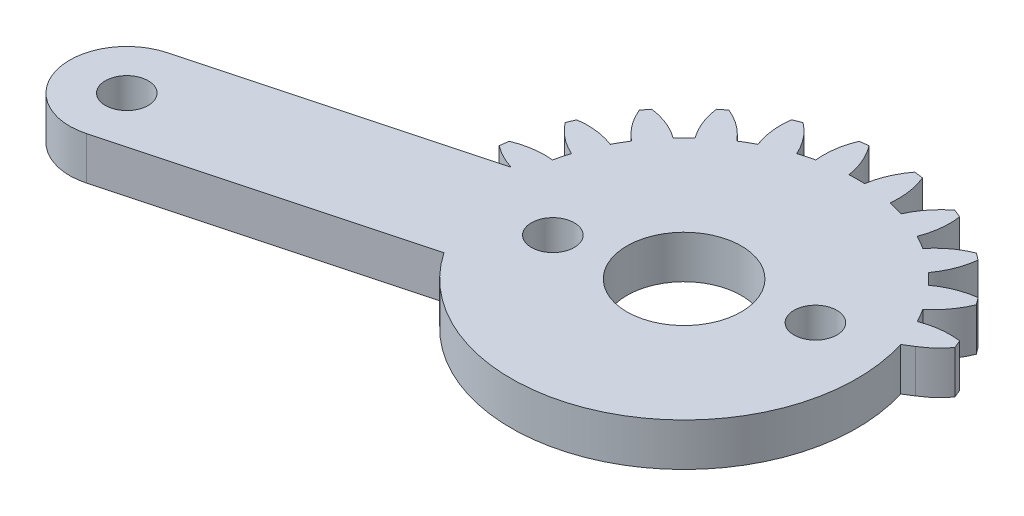
from build123d import *
from build123d.topology import SkipClean

# Parameters (mm, degrees)
SKETCH1_R           = 1.5
BOSS_EXTRUDE1_DEPTH = 3
SKETCH3_R           = 1.5
BOSS_EXTRUDE2_DEPTH = 3
CUT_EXTRUDE1_START  = -3
CUT_EXTRUDE1_DEPTH  = 3
CUT_EXTRUDE2_REACH  = 49.249
SKETCH5_R           = 1.5
SKETCH5_R_2         = 4


with BuildPart() as part:
    # Sketch1 → Boss-Extrude1 (new body)
    with BuildSketch(Plane(origin=(0, 0, 0), x_dir=(1, 0, 0), z_dir=(0, 1, 0))):
        with BuildLine():
            Line((20.643657446, 4), (2.081641936, 4))
            ThreePointArc((2.081641936, 4), (2.861028333, 4.588201733), (3.521749436, 5.30713988))
            ThreePointArc((3.521749436, 5.30713988), (3.405395609, 5.596745198), (3.282888305, 5.883801663))
            ThreePointArc((3.282888305, 5.883801663), (1.93527598, 5.894040025), (0.627094961, 5.57027124))
            ThreePointArc((0.627094961, 5.57027124), (0.366286148, 6.046375), (0.084372603, 6.510293938))
            ThreePointArc((0.084372603, 6.510293938), (1.018855105, 7.48132754), (1.683794586, 8.65351323))
            ThreePointArc((1.683794586, 8.65351323), (1.496450048, 8.903135899), (1.303821399, 9.148703928))
            ThreePointArc((1.303821399, 9.148703928), (-0.000522033, 8.809805691), (-1.180330337, 8.158486898))
            ThreePointArc((-1.180330337, 8.158486898), (-1.555477026, 8.550865528), (-1.947855656, 8.926012217))
            ThreePointArc((-1.947855656, 8.926012217), (-1.296536862, 10.105820521), (-0.957638625, 11.410163953))
            ThreePointArc((-0.957638625, 11.410163953), (-1.203206655, 11.602792602), (-1.452829324, 11.79013714))
            ThreePointArc((-1.452829324, 11.79013714), (-2.625015014, 11.125197659), (-3.596048616, 10.190715157))
            ThreePointArc((-3.596048616, 10.190715157), (-4.059967554, 10.472628702), (-4.536071314, 10.733437515))
            ThreePointArc((-4.536071314, 10.733437515), (-4.212302529, 12.041618533), (-4.222540891, 13.389230859))
            ThreePointArc((-4.222540891, 13.389230859), (-4.509597355, 13.511738163), (-4.799202674, 13.62809199))
            ThreePointArc((-4.799202674, 13.62809199), (-5.759348103, 12.682425791), (-6.455432668, 11.528463019))
            ThreePointArc((-6.455432668, 11.528463019), (-6.976508546, 11.680699536), (-7.503891752, 11.809396783))
            ThreePointArc((-7.503891752, 11.809396783), (-7.529737283, 13.156800143), (-7.888414517, 14.455843809))
            ThreePointArc((-7.888414517, 14.455843809), (-8.197396993, 14.499881098), (-8.507248835, 14.537314892))
            ThreePointArc((-8.507248835, 14.537314892), (-9.18992168, 13.375367565), (-9.563620196, 12.080565177))
            ThreePointArc((-9.563620196, 12.080565177), (-10.106342554, 12.09275), (-10.649064912, 12.080565177))
            ThreePointArc((-10.649064912, 12.080565177), (-11.022763428, 13.375367565), (-11.705436272, 14.537314892))
            ThreePointArc((-11.705436272, 14.537314892), (-12.015288115, 14.499881098), (-12.324270591, 14.455843809))
            ThreePointArc((-12.324270591, 14.455843809), (-12.682947825, 13.156800143), (-12.708793355, 11.809396783))
            ThreePointArc((-12.708793355, 11.809396783), (-13.236176561, 11.680699536), (-13.757252439, 11.528463019))
            ThreePointArc((-13.757252439, 11.528463019), (-14.453337005, 12.682425791), (-15.413482434, 13.62809199))
            ThreePointArc((-15.413482434, 13.62809199), (-15.703087752, 13.511738163), (-15.990144217, 13.389230859))
            ThreePointArc((-15.990144217, 13.389230859), (-16.000382579, 12.041618533), (-15.676613793, 10.733437515))
            ThreePointArc((-15.676613793, 10.733437515), (-16.152717554, 10.472628702), (-16.616636492, 10.190715157))
            ThreePointArc((-16.616636492, 10.190715157), (-17.587670094, 11.125197659), (-18.759855783, 11.79013714))
            ThreePointArc((-18.759855783, 11.79013714), (-19.009478453, 11.602792602), (-19.255046482, 11.410163953))
            ThreePointArc((-19.255046482, 11.410163953), (-18.916148245, 10.105820521), (-18.264829452, 8.926012217))
            ThreePointArc((-18.264829452, 8.926012217), (-18.657208082, 8.550865528), (-19.032354771, 8.158486898))
            ThreePointArc((-19.032354771, 8.158486898), (-20.212163074, 8.809805691), (-21.516506507, 9.148703928))
            ThreePointArc((-21.516506507, 9.148703928), (-21.709135156, 8.903135899), (-21.896479694, 8.65351323))
            ThreePointArc((-21.896479694, 8.65351323), (-21.231540213, 7.48132754), (-20.297057711, 6.510293938))
            ThreePointArc((-20.297057711, 6.510293938), (-20.578971255, 6.046375), (-20.839780068, 5.57027124))
            ThreePointArc((-20.839780068, 5.57027124), (-22.147961087, 5.894040025), (-23.495573413, 5.883801663))
            ThreePointArc((-23.495573413, 5.883801663), (-23.618080717, 5.596745198), (-23.734434544, 5.30713988))
            ThreePointArc((-23.734434544, 5.30713988), (-22.788768345, 4.346994451), (-21.634805572, 3.650909885))
            ThreePointArc((-21.634805572, 3.650909885), (-21.78704209, 3.129834008), (-21.915739337, 2.602450802))
            ThreePointArc((-21.915739337, 2.602450802), (-23.263142697, 2.576605271), (-24.562186363, 2.217928037))
            ThreePointArc((-24.562186363, 2.217928037), (-24.606223651, 1.908945561), (-24.643657446, 1.599093719))
            ThreePointArc((-24.643657446, 1.599093719), (-23.481710119, 0.916420874), (-22.186907731, 0.542722358))
            ThreePointArc((-22.186907731, 0.542722358), (-22.199092554, 0), (-22.186907731, -0.542722358))
            ThreePointArc((-22.186907731, -0.542722358), (-23.481710119, -0.916420874), (-24.643657446, -1.599093719))
            ThreePointArc((-24.643657446, -1.599093719), (-24.606223651, -1.908945561), (-24.562186363, -2.217928037))
            ThreePointArc((-24.562186363, -2.217928037), (-23.263142697, -2.576605271), (-21.915739337, -2.602450802))
            ThreePointArc((-21.915739337, -2.602450802), (-21.78704209, -3.129834008), (-21.634805572, -3.650909885))
            ThreePointArc((-21.634805572, -3.650909885), (-22.788768345, -4.346994451), (-23.734434544, -5.30713988))
            ThreePointArc((-23.734434544, -5.30713988), (-23.618080717, -5.596745198), (-23.495573413, -5.883801663))
            ThreePointArc((-23.495573413, -5.883801663), (-22.147961087, -5.894040025), (-20.839780068, -5.57027124))
            ThreePointArc((-20.839780068, -5.57027124), (-20.578971255, -6.046375), (-20.297057711, -6.510293938))
            ThreePointArc((-20.297057711, -6.510293938), (-21.231540213, -7.48132754), (-21.896479694, -8.65351323))
            ThreePointArc((-21.896479694, -8.65351323), (-21.709135156, -8.903135899), (-21.516506507, -9.148703928))
            ThreePointArc((-21.516506507, -9.148703928), (-20.212163074, -8.809805691), (-19.032354771, -8.158486898))
            ThreePointArc((-19.032354771, -8.158486898), (-18.657208082, -8.550865528), (-18.264829452, -8.926012217))
            ThreePointArc((-18.264829452, -8.926012217), (-18.916148245, -10.105820521), (-19.255046482, -11.410163953))
            ThreePointArc((-19.255046482, -11.410163953), (-19.009478453, -11.602792602), (-18.759855783, -11.79013714))
            ThreePointArc((-18.759855783, -11.79013714), (-17.587670094, -11.125197659), (-16.616636492, -10.190715157))
            ThreePointArc((-16.616636492, -10.190715157), (-16.152717554, -10.472628702), (-15.676613793, -10.733437515))
            ThreePointArc((-15.676613793, -10.733437515), (-16.000382579, -12.041618533), (-15.990144217, -13.389230859))
            ThreePointArc((-15.990144217, -13.389230859), (-15.703087752, -13.511738163), (-15.413482434, -13.62809199))
            ThreePointArc((-15.413482434, -13.62809199), (-14.453337005, -12.682425791), (-13.757252439, -11.528463019))
            ThreePointArc((-13.757252439, -11.528463019), (-13.236176561, -11.680699536), (-12.708793355, -11.809396783))
            ThreePointArc((-12.708793355, -11.809396783), (-12.682947825, -13.156800143), (-12.324270591, -14.455843809))
            ThreePointArc((-12.324270591, -14.455843809), (-12.015288115, -14.499881098), (-11.705436272, -14.537314892))
            ThreePointArc((-11.705436272, -14.537314892), (-11.022763428, -13.375367565), (-10.649064912, -12.080565177))
            ThreePointArc((-10.649064912, -12.080565177), (-10.106342554, -12.09275), (-9.563620196, -12.080565177))
            ThreePointArc((-9.563620196, -12.080565177), (-9.18992168, -13.375367565), (-8.507248835, -14.537314892))
            ThreePointArc((-8.507248835, -14.537314892), (-8.197396993, -14.499881098), (-7.888414517, -14.455843809))
            ThreePointArc((-7.888414517, -14.455843809), (-7.529737283, -13.156800143), (-7.503891752, -11.809396783))
            ThreePointArc((-7.503891752, -11.809396783), (-6.976508546, -11.680699536), (-6.455432668, -11.528463019))
            ThreePointArc((-6.455432668, -11.528463019), (-5.759348103, -12.682425791), (-4.799202674, -13.62809199))
            ThreePointArc((-4.799202674, -13.62809199), (-4.509597355, -13.511738163), (-4.222540891, -13.389230859))
            ThreePointArc((-4.222540891, -13.389230859), (-4.212302529, -12.041618533), (-4.536071314, -10.733437515))
            ThreePointArc((-4.536071314, -10.733437515), (-4.059967554, -10.472628702), (-3.596048616, -10.190715157))
            ThreePointArc((-3.596048616, -10.190715157), (-2.625015014, -11.125197659), (-1.452829324, -11.79013714))
            ThreePointArc((-1.452829324, -11.79013714), (-1.203206655, -11.602792602), (-0.957638625, -11.410163953))
            ThreePointArc((-0.957638625, -11.410163953), (-1.296536862, -10.105820521), (-1.947855656, -8.926012217))
            ThreePointArc((-1.947855656, -8.926012217), (-1.555477026, -8.550865528), (-1.180330337, -8.158486898))
            ThreePointArc((-1.180330337, -8.158486898), (-0.000522033, -8.809805691), (1.303821399, -9.148703928))
            ThreePointArc((1.303821399, -9.148703928), (1.496450048, -8.903135899), (1.683794586, -8.65351323))
            ThreePointArc((1.683794586, -8.65351323), (1.018855105, -7.48132754), (0.084372603, -6.510293938))
            ThreePointArc((0.084372603, -6.510293938), (0.366286148, -6.046375), (0.627094961, -5.57027124))
            ThreePointArc((0.627094961, -5.57027124), (1.93527598, -5.894040025), (3.282888305, -5.883801663))
            ThreePointArc((3.282888305, -5.883801663), (3.405395609, -5.596745198), (3.521749436, -5.30713988))
            ThreePointArc((3.521749436, -5.30713988), (2.861028333, -4.588201733), (2.081641936, -4))
            Line((2.081641936, -4), (20.643657446, -4))
            ThreePointArc((20.643657446, -4), (24.643657446, 0), (20.643657446, 4))
        make_face()
        with Locations(Location((-10.106342554, 0, 0), (0, 0, 270))):
            Circle(SKETCH1_R, mode=Mode.SUBTRACT)
        with Locations(Location((20.643657446, 0, 0), (0, 0, 270))):
            Circle(SKETCH1_R, mode=Mode.SUBTRACT)
    extrude(amount=BOSS_EXTRUDE1_DEPTH)

    # Sketch3 → Boss-Extrude2 (add)
    with BuildSketch(Plane(origin=(0, 3, 0), x_dir=(1, 0, 0), z_dir=(0, 1, 0))):
        with BuildLine():
            ThreePointArc((-9.071066373, -3.863703305), (-13.970045859, -1.03527618), (-11.141618734, 3.863703305))
            Line((-11.141618734, 3.863703305), (-41.891618734, -4.375734362))
            ThreePointArc((-41.891618734, -4.375734362), (-44.720045859, -9.274713848), (-39.821066373, -12.103140972))
            Line((-39.821066373, -12.103140972), (-9.071066373, -3.863703305))
        make_face()
        with Locations(Location((-40.856342554, -8.239437667, 0), (0, 0, 270))):
            Circle(SKETCH3_R, mode=Mode.SUBTRACT)
    extrude(amount=-BOSS_EXTRUDE2_DEPTH)

    # Sketch4 → Cut-Extrude1 (cut)
    with SkipClean():  # the faces are left unmerged after this step: merging them gives an invalid solid
        with BuildSketch(Plane(origin=(0, 3, 0), x_dir=(1, 0, 0), z_dir=(0, 1, 0)).offset(CUT_EXTRUDE1_START)):
            with BuildLine():
                ThreePointArc((-21.516506507, -9.148703928), (-20.212163074, -8.809805691), (-19.032354771, -8.158486898))
                ThreePointArc((-19.032354771, -8.158486898), (-19.58704562, -7.506721784), (-20.094248238, -6.817355984))
                Line((-20.094248238, -6.817355984), (-20.843755363, -7.018185813))
                ThreePointArc((-20.843755363, -7.018185813), (-21.444347002, -7.788065101), (-21.896479694, -8.65351323))
                ThreePointArc((-21.896479694, -8.65351323), (-21.709135156, -8.903135899), (-21.516506507, -9.148703928))
            make_face()
            with BuildLine():
                ThreePointArc((-18.759855783, -11.79013714), (-17.587670094, -11.125197659), (-16.616636492, -10.190715157))
                ThreePointArc((-16.616636492, -10.190715157), (-17.467942324, -9.593823606), (-18.264829452, -8.926012217))
                ThreePointArc((-18.264829452, -8.926012217), (-18.916148245, -10.105820521), (-19.255046482, -11.410163953))
                ThreePointArc((-19.255046482, -11.410163953), (-19.009478453, -11.602792602), (-18.759855783, -11.79013714))
            make_face()
            with BuildLine():
                ThreePointArc((-15.413482434, -13.62809199), (-14.453337005, -12.682425791), (-13.757252439, -11.528463019))
                ThreePointArc((-13.757252439, -11.528463019), (-14.734037631, -11.172244217), (-15.676613793, -10.733437515))
                ThreePointArc((-15.676613793, -10.733437515), (-16.000382579, -12.041618533), (-15.990144217, -13.389230859))
                ThreePointArc((-15.990144217, -13.389230859), (-15.703087752, -13.511738163), (-15.413482434, -13.62809199))
            make_face()
            with BuildLine():
                ThreePointArc((-11.705436272, -14.537314892), (-11.022763428, -13.375367565), (-10.649064912, -12.080565177))
                ThreePointArc((-10.649064912, -12.080565177), (-11.684763165, -11.989294847), (-12.708793355, -11.809396783))
                ThreePointArc((-12.708793355, -11.809396783), (-12.682947825, -13.156800143), (-12.324270591, -14.455843809))
                ThreePointArc((-12.324270591, -14.455843809), (-12.015288115, -14.499881098), (-11.705436272, -14.537314892))
            make_face()
            with BuildLine():
                ThreePointArc((-7.888414517, -14.455843809), (-7.529737283, -13.156800143), (-7.503891752, -11.809396783))
                ThreePointArc((-7.503891752, -11.809396783), (-8.527921943, -11.989294847), (-9.563620196, -12.080565177))
                ThreePointArc((-9.563620196, -12.080565177), (-9.18992168, -13.375367565), (-8.507248835, -14.537314892))
                ThreePointArc((-8.507248835, -14.537314892), (-8.197396993, -14.499881098), (-7.888414517, -14.455843809))
            make_face()
            with BuildLine():
                ThreePointArc((-4.222540891, -13.389230859), (-4.212302529, -12.041618533), (-4.536071314, -10.733437515))
                ThreePointArc((-4.536071314, -10.733437515), (-5.478647477, -11.172244217), (-6.455432668, -11.528463019))
                ThreePointArc((-6.455432668, -11.528463019), (-5.759348103, -12.682425791), (-4.799202674, -13.62809199))
                ThreePointArc((-4.799202674, -13.62809199), (-4.509597355, -13.511738163), (-4.222540891, -13.389230859))
            make_face()
            with BuildLine():
                ThreePointArc((-0.957638625, -11.410163953), (-1.296536862, -10.105820521), (-1.947855656, -8.926012217))
                ThreePointArc((-1.947855656, -8.926012217), (-2.744742783, -9.593823606), (-3.596048616, -10.190715157))
                ThreePointArc((-3.596048616, -10.190715157), (-2.625015014, -11.125197659), (-1.452829324, -11.79013714))
                ThreePointArc((-1.452829324, -11.79013714), (-1.203206655, -11.602792602), (-0.957638625, -11.410163953))
            make_face()
            with BuildLine():
                ThreePointArc((1.683794586, -8.65351323), (1.018855105, -7.48132754), (0.084372603, -6.510293938))
                ThreePointArc((0.084372603, -6.510293938), (-0.512518948, -7.361599771), (-1.180330337, -8.158486898))
                ThreePointArc((-1.180330337, -8.158486898), (-0.000522033, -8.809805691), (1.303821399, -9.148703928))
                ThreePointArc((1.303821399, -9.148703928), (1.496450048, -8.903135899), (1.683794586, -8.65351323))
            make_face()
            with BuildLine():
                ThreePointArc((20.643657446, -4), (24.643657446, 0), (20.643657446, 4))
                Line((20.643657446, 4), (2.081641936, 4))
                Line((2.081641936, 4), (1.43808022, 3.600125745))
                ThreePointArc((1.43808022, 3.600125745), (1.848539735, 1.820821801), (1.986407446, 0))
                ThreePointArc((1.986407446, 0), (1.641665343, -2.866864669), (0.627094961, -5.57027124))
                ThreePointArc((0.627094961, -5.57027124), (1.93527598, -5.894040025), (3.282888305, -5.883801663))
                ThreePointArc((3.282888305, -5.883801663), (3.405395609, -5.596745198), (3.521749436, -5.30713988))
                ThreePointArc((3.521749436, -5.30713988), (2.861028333, -4.588201733), (2.081641936, -4))
                Line((2.081641936, -4), (20.643657446, -4))
            make_face()
        extrude(amount=CUT_EXTRUDE1_DEPTH, mode=Mode.SUBTRACT)

    # Sketch5 → Cut-Extrude2 (cut, up to next)
    with BuildSketch(Plane(origin=(0, 3, 0), x_dir=(1, 0, 0), z_dir=(0, 1, 0)), mode=Mode.PRIVATE) as cut_extrude2_sk1:
        with Locations(Location((-2.861898857, 1.941142838, 0), (0, 0, 270))):
            Circle(SKETCH5_R)
    cut_extrude2_tool1 = extrude(cut_extrude2_sk1.sketch, amount=-CUT_EXTRUDE2_REACH, mode=Mode.PRIVATE) & part.part
    # Sketch5 → Cut-Extrude2 (cut, up to next)
    with BuildSketch(Plane(origin=(0, 3, 0), x_dir=(1, 0, 0), z_dir=(0, 1, 0)), mode=Mode.PRIVATE) as cut_extrude2_sk2:
        with Locations(Location((-17.350786251, -1.941142838, 0), (0, 0, 270))):
            Circle(SKETCH5_R)
    cut_extrude2_tool2 = extrude(cut_extrude2_sk2.sketch, amount=-CUT_EXTRUDE2_REACH, mode=Mode.PRIVATE) & part.part
    # Sketch5 → Cut-Extrude2 (cut, up to next)
    with BuildSketch(Plane(origin=(0, 3, 0), x_dir=(1, 0, 0), z_dir=(0, 1, 0)), mode=Mode.PRIVATE) as cut_extrude2_sk3:
        with Locations(Location((-10.106342554, 0, 0), (0, 0, 270))):
            Circle(SKETCH5_R_2)
    cut_extrude2_tool3 = extrude(cut_extrude2_sk3.sketch, amount=-CUT_EXTRUDE2_REACH, mode=Mode.PRIVATE) & part.part
    add(cut_extrude2_tool1.solids().sort_by_distance((-2.861899, 3, -1.941143))[0], mode=Mode.SUBTRACT)
    add(cut_extrude2_tool2.solids().sort_by_distance((-17.350786, 3, 1.941143))[0], mode=Mode.SUBTRACT)
    add(cut_extrude2_tool3.solids().sort_by_distance((-10.106343, 3, 0))[0], mode=Mode.SUBTRACT)


solid = part.part
